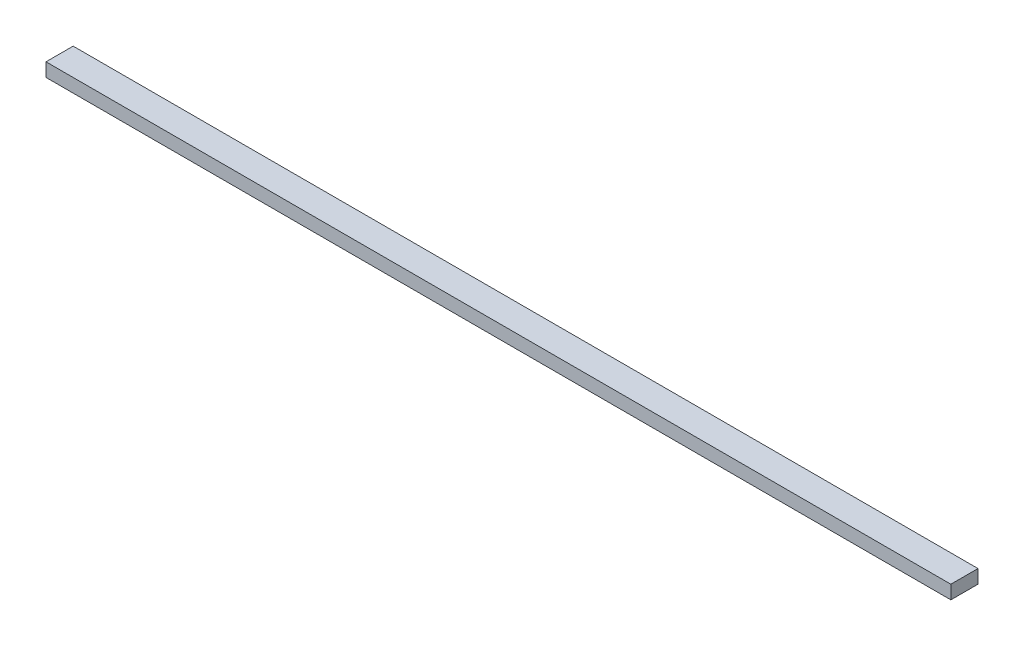
from build123d import *

# Parameters (mm, degrees)
SKETCH_1_W      = 200
SKETCH_1_H      = 6
EXTRUDE_1_DEPTH = 3


with BuildPart() as part:
    # 草图1 → 凸台-拉伸1 (new body)
    with BuildSketch(Plane(origin=(0, 0, 0), x_dir=(1, 0, 0), z_dir=(0, 1, 0))):
        Rectangle(SKETCH_1_W, SKETCH_1_H)
    extrude(amount=EXTRUDE_1_DEPTH)


solid = part.part
